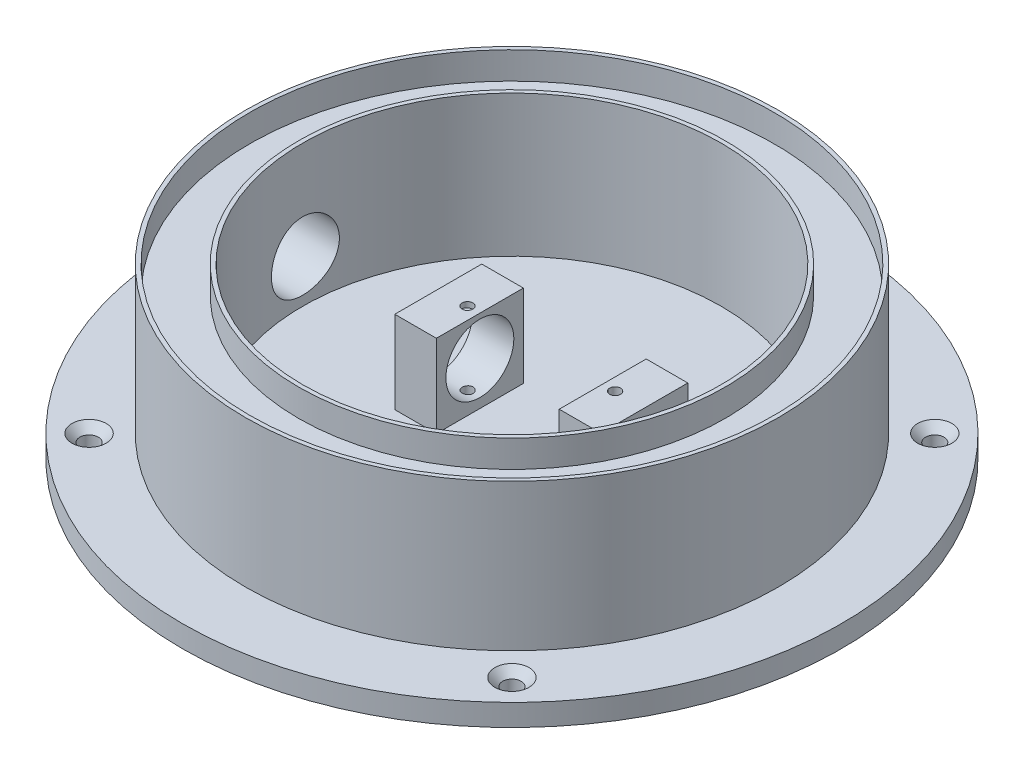
from build123d import *

# Parameters (mm, degrees)
SKETCH1_R                                           = 60.625
SKETCH1_R_2                                         = 45
BOSS_EXTRUDE1_DEPTH                                 = 4
SKETCH2_R                                           = 49
SKETCH2_R_2                                         = 45
BOSS_EXTRUDE2_DEPTH                                 = 27
SKETCH4_W                                           = 7.65
SKETCH4_H                                           = 16.2
BOSS_EXTRUDE4_DEPTH                                 = 8
BOSS_EXTRUDE4_2_DEPTH                               = 8
SKETCH5_R                                           = 45
BOSS_EXTRUDE5_DEPTH                                 = 5
SKETCH18_R                                          = 45.113728165
SKETCH18_R_2                                        = 38.5
BOSS_EXTRUDE6_DEPTH                                 = 31
CUT_EXTRUDE8_START                                  = -35
SKETCH11_R                                          = 6.25
CUT_EXTRUDE8_DEPTH                                  = 95.050498837
CSK_FOR_M3_COUNTERSUNK_FLAT_HEAD_SCREW1_D           = 3.4
CSK_FOR_M3_COUNTERSUNK_FLAT_HEAD_SCREW1_CSINK_D     = 6.3
CSK_FOR_M3_COUNTERSUNK_FLAT_HEAD_SCREW1_CSINK_ANGLE = 90
SKETCH27_R                                          = 1
CUT_EXTRUDE11_DEPTH                                 = 16
SKETCH28_R                                          = 48.25
SKETCH28_R_2                                        = 39.25
CUT_EXTRUDE12_DEPTH                                 = 5


with BuildPart() as part:
    # Sketch1 → Boss-Extrude1 (new body)
    with BuildSketch(Plane(origin=(0, 0, 0), x_dir=(1, 0, 0), z_dir=(0, 1, 0))):
        with Locations(Location((0, 0, 0), (0, 0, 270))):
            Circle(SKETCH1_R)
        with Locations(Location((0, 0, 0), (0, 0, 270))):
            Circle(SKETCH1_R_2, mode=Mode.SUBTRACT)
    extrude(amount=BOSS_EXTRUDE1_DEPTH)

    # Sketch2 → Boss-Extrude2 (add)
    with BuildSketch(Plane(origin=(0, 4, 0), x_dir=(1, 0, 0), z_dir=(0, 1, 0))):
        with Locations(Location((0, 0, 0), (0, 0, 270))):
            Circle(SKETCH2_R)
        with Locations(Location((0, 0, 0), (0, 0, 270))):
            Circle(SKETCH2_R_2, mode=Mode.SUBTRACT)
    extrude(amount=BOSS_EXTRUDE2_DEPTH)



with BuildPart() as body_2:
    # Sketch4 → Boss-Extrude4 (new, symmetric)
    with BuildSketch(Plane.XY):
        with Locations((-9.725, 12.1)):
            Rectangle(SKETCH4_W, SKETCH4_H)
    extrude(amount=BOSS_EXTRUDE4_DEPTH, both=True)


with BuildPart() as body_3:
    # Sketch4 → Boss-Extrude4 2 (new, symmetric)
    with BuildSketch(Plane.XY):
        with Locations((20.525, 12.1)):
            Rectangle(SKETCH4_W, SKETCH4_H)
    extrude(amount=BOSS_EXTRUDE4_2_DEPTH, both=True)


with BuildPart() as part_1:
    add(part.part)

    add(body_2.part)  # Boss-Extrude5 merges body 2

    add(body_3.part)  # Boss-Extrude5 merges body 3
    # Sketch5 → Boss-Extrude5 (add)
    with BuildSketch(Plane.XZ):
        with Locations(Location((0, 0, 0), (0, 0, 270))):
            Circle(SKETCH5_R)
    extrude(amount=-BOSS_EXTRUDE5_DEPTH)

    # Sketch18 → Boss-Extrude6 (add)
    with BuildSketch(Plane(origin=(0, 31, 0), x_dir=(1, 0, 0), z_dir=(0, 1, 0))):
        Circle(SKETCH18_R)
        with Locations(Location((0, 0, 0), (0, 0, 270))):
            Circle(SKETCH18_R_2, mode=Mode.SUBTRACT)
    extrude(amount=-BOSS_EXTRUDE6_DEPTH)

    # Sketch11 → Cut-Extrude8 (cut, through all)
    with BuildSketch(Plane(origin=(49, 0, 0), x_dir=(0, 0, -1), z_dir=(1, 0, 0)).offset(CUT_EXTRUDE8_START)):
        with Locations((0, 13)):
            Circle(SKETCH11_R)
    extrude(amount=-CUT_EXTRUDE8_DEPTH, mode=Mode.SUBTRACT)

    # CSK for M3 Countersunk Flat Head Screw1 (through all)
    with Locations(Plane(origin=(0, 4, 0), x_dir=(1, 0, 0), z_dir=(0, 1, 0))):
        with Locations((-38.890872965, 38.890872965), (-38.890872965, -38.890872965), (38.890872965, -38.890872965), (38.890872965, 38.890872965)):
            CounterSinkHole(CSK_FOR_M3_COUNTERSUNK_FLAT_HEAD_SCREW1_D / 2, CSK_FOR_M3_COUNTERSUNK_FLAT_HEAD_SCREW1_CSINK_D / 2, counter_sink_angle=CSK_FOR_M3_COUNTERSUNK_FLAT_HEAD_SCREW1_CSINK_ANGLE)

    # Sketch27 → Cut-Extrude11 (cut)
    with BuildSketch(Plane(origin=(0, 20.2, 0), x_dir=(1, 0, 0), z_dir=(0, 1, 0))):
        with Locations(Location((-8.175, 0, 0), (0, 0, 270))):
            Circle(SKETCH27_R)
        with Locations(Location((18.975, 0, 0), (0, 0, 270))):
            Circle(SKETCH27_R)
    extrude(amount=-CUT_EXTRUDE11_DEPTH, mode=Mode.SUBTRACT)

    # Sketch28 → Cut-Extrude12 (cut)
    with BuildSketch(Plane(origin=(0, 31, 0), x_dir=(1, 0, 0), z_dir=(0, 1, 0))):
        with Locations(Location((0, 0, 0), (0, 0, 270))):
            Circle(SKETCH28_R)
        with Locations(Location((0, 0, 0), (0, 0, 270))):
            Circle(SKETCH28_R_2, mode=Mode.SUBTRACT)
    extrude(amount=-CUT_EXTRUDE12_DEPTH, mode=Mode.SUBTRACT)


solid = part_1.part
